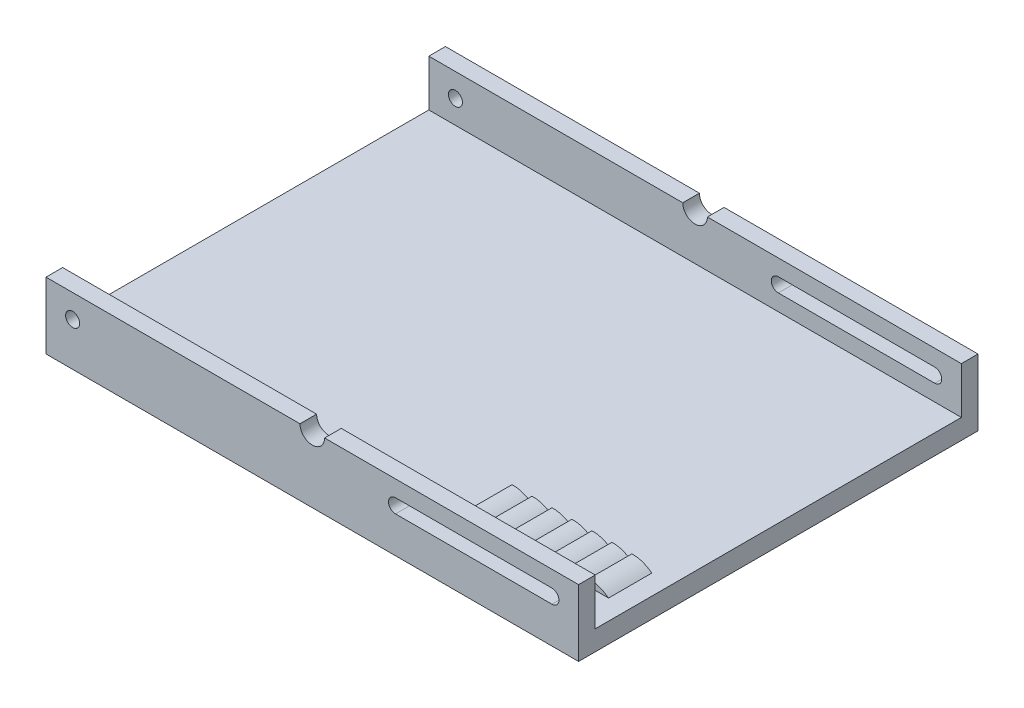
from build123d import *

# Parameters (mm, degrees)
AUFSATZ_LINEAR_AUSTRAGEN3_DEPTH      = 80
SCHNITT_LINEAR_AUSTRAGEN1_DEPTH      = 146.602197786
SCHNITT_LINEAR_AUSTRAGEN1_DEPTH_BACK = 146.602197786
SKIZZE10_R                           = 2.1
SCHNITT_LINEAR_AUSTRAGEN2_DEPTH      = 102.980390272
SCHNITT_LINEAR_AUSTRAGEN2_DEPTH_BACK = 102.980390272
AUFSATZ_LINEAR_AUSTRAGEN4_DEPTH      = 45
LINEARES_MUSTER1_COUNT               = 7
LINEARES_MUSTER1_PITCH               = 6
SKIZZE19_W                           = 160
SKIZZE19_H                           = 14
SCHNITT_LINEAR_AUSTRAGEN3_DEPTH      = 32


with BuildPart() as part:
    # Skizze9 → Aufsatz-Linear austragen3 (new, symmetric)
    with BuildSketch(Plane(origin=(0, 0, 0), x_dir=(0, 0, -1), z_dir=(1, 0, 0))):
        Polygon((-60, 20), (-60, 0), (60, 0), (60, 20), (55, 20), (55, 6), (-55, 6), (-55, 20), align=None)
    extrude(amount=AUFSATZ_LINEAR_AUSTRAGEN3_DEPTH, both=True)

    # Skizze10 → Schnitt-Linear austragen1 (cut, two sides: drawn at the far end of the back side and taken through both)
    with BuildSketch(Plane.XY.offset(60).offset(-SCHNITT_LINEAR_AUSTRAGEN1_DEPTH_BACK)):
        with Locations((-72, 13)):
            Circle(SKIZZE10_R)
        with BuildLine():
            Line((25, 15.1), (72, 15.1))
            ThreePointArc((72, 15.1), (74.1, 13), (72, 10.9))
            Line((72, 10.9), (25, 10.9))
            ThreePointArc((25, 10.9), (22.9, 13), (25, 15.1))
        make_face()
    extrude(amount=SCHNITT_LINEAR_AUSTRAGEN1_DEPTH + SCHNITT_LINEAR_AUSTRAGEN1_DEPTH_BACK, mode=Mode.SUBTRACT)

    # Skizze12 → Schnitt-Linear austragen2 (cut, two sides: drawn at the far end of the back side and taken through both)
    with BuildSketch(Plane.XY.offset(-SCHNITT_LINEAR_AUSTRAGEN2_DEPTH_BACK)):
        with BuildLine():
            Line((-3.7, 20), (3.7, 20))
            ThreePointArc((3.7, 20), (0, 16.3), (-3.7, 20))
        make_face()
    extrude(amount=SCHNITT_LINEAR_AUSTRAGEN2_DEPTH + SCHNITT_LINEAR_AUSTRAGEN2_DEPTH_BACK, mode=Mode.SUBTRACT)

    # Skizze18 → Aufsatz-Linear austragen4 (add)
    with BuildSketch(Plane(origin=(0, 0, 0), x_dir=(-1, 0, 0), z_dir=(0, 0, -1))):
        with BuildLine():
            Line((-32, 6), (-38, 6))
            add(Edge.make_bspline(
                [(-38, 6), (-35.16767955, 8.124664511), (-32, 8)],
                knots=[0, 0, 0, 0.477297659, 0.477297659, 0.477297659], degree=2))
            Line((-32, 8), (-32, 6))
        make_face()
    aufsatz_linear_austragen4 = extrude(amount=-AUFSATZ_LINEAR_AUSTRAGEN4_DEPTH)

    # Lineares Muster1: Aufsatz-Linear austragen4 ×7
    with Locations(*[(i * LINEARES_MUSTER1_PITCH, 0, 0) for i in range(1, LINEARES_MUSTER1_COUNT)]):
        add(aufsatz_linear_austragen4)

    # Skizze19 → Schnitt-Linear austragen3 (cut)
    with BuildSketch(Plane.XY):
        with Locations((0, 13)):
            Rectangle(SKIZZE19_W, SKIZZE19_H)
    extrude(amount=SCHNITT_LINEAR_AUSTRAGEN3_DEPTH, mode=Mode.SUBTRACT)


solid = part.part
